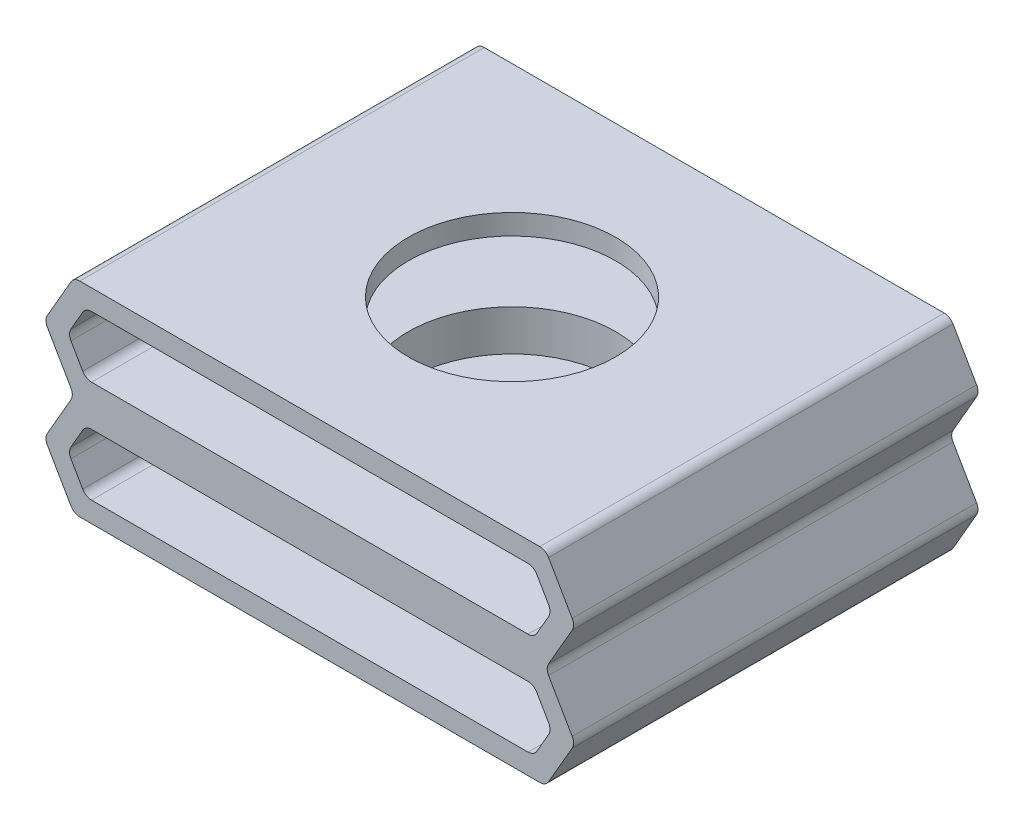
from build123d import *

# Parameters (mm, degrees)
BOSS_EXTRUDE5_DEPTH = 19.8
SKETCH6_R           = 5.075
CUT_EXTRUDE1_DEPTH  = 10
FILLET2_R           = 0.5


with BuildPart() as part:
    # Sketch5 → Boss-Extrude5 (new body)
    with BuildSketch(Plane.XY):
        Polygon((4.330127019, 2.5), (1.443375673, 2.5), (-1.443375673, 2.5), (-2.886751346, 0), (-1.443375673, -2.5), (-2.886751346, -5), (-1.443375673, -7.5), (1.443375673, -7.5), (4.330127019, -7.5), (7.216878365, -7.5), (10.103629711, -7.5), (12.990381057, -7.5), (15.877132403, -7.5), (18.763883749, -7.5), (21.650635095, -7.5), (23.094010768, -5), (21.650635095, -2.5), (23.094010768, 0), (21.650635095, 2.5), (18.763883749, 2.5), (15.877132403, 2.5), (12.990381057, 2.5), (10.103629711, 2.5), (7.216878365, 2.5), align=None)
        Polygon((-0.866025404, -3.5), (0.866025404, -3.5), (2.020725942, -3.5), (19.341234018, -3.5), (21.073284825, -3.5), (21.939310229, -5), (21.073284825, -6.5), (19.341234018, -6.5), (0.866025404, -6.5), (-0.866025404, -6.5), (-1.732050808, -5), align=None, mode=Mode.SUBTRACT)
        Polygon((-0.866025404, 1.5), (0.866025404, 1.5), (18.186533479, 1.5), (19.341234018, 1.5), (21.073284825, 1.5), (21.939310229, 0), (21.073284825, -1.5), (19.341234018, -1.5), (0.866025404, -1.5), (-0.866025404, -1.5), (-1.732050808, 0), align=None, mode=Mode.SUBTRACT)
    extrude(amount=BOSS_EXTRUDE5_DEPTH)

    # Sketch6 → Cut-Extrude1 (cut)
    with BuildSketch(Plane.XZ.offset(7.5)):
        with Locations((10.103629827, 9.9)):
            Circle(SKETCH6_R)
    extrude(amount=-CUT_EXTRUDE1_DEPTH, mode=Mode.SUBTRACT)

    # Fillet2
    fillet2_edges = [part.edges().sort_by_distance(p)[0] for p in [
        (21.073284825, -3.5, 9.9),
        (-0.866025404, -3.5, 9.9),
        (-1.732050808, -5, 9.9),
        (-0.866025404, -6.5, 9.9),
        (21.073284825, -6.5, 9.9),
        (21.939310229, -5, 9.9),
        (21.650635095, 2.5, 9.9),
        (23.094010768, 0, 9.9),
        (21.650635095, -2.5, 9.9),
        (23.094010768, -5, 9.9),
        (21.650635095, -7.5, 9.9),
        (-1.443375673, -7.5, 9.9),
        (-2.886751346, -5, 9.9),
        (-1.443375673, -2.5, 9.9),
        (-2.886751346, 0, 9.9),
        (-1.443375673, 2.5, 9.9),
        (21.073284825, 1.5, 9.9),
        (-0.866025404, 1.5, 9.9),
        (-1.732050808, 0, 9.9),
        (-0.866025404, -1.5, 9.9),
        (21.073284825, -1.5, 9.9),
        (21.939310229, 0, 9.9),
    ]]
    fillet(fillet2_edges, radius=FILLET2_R)


solid = part.part
